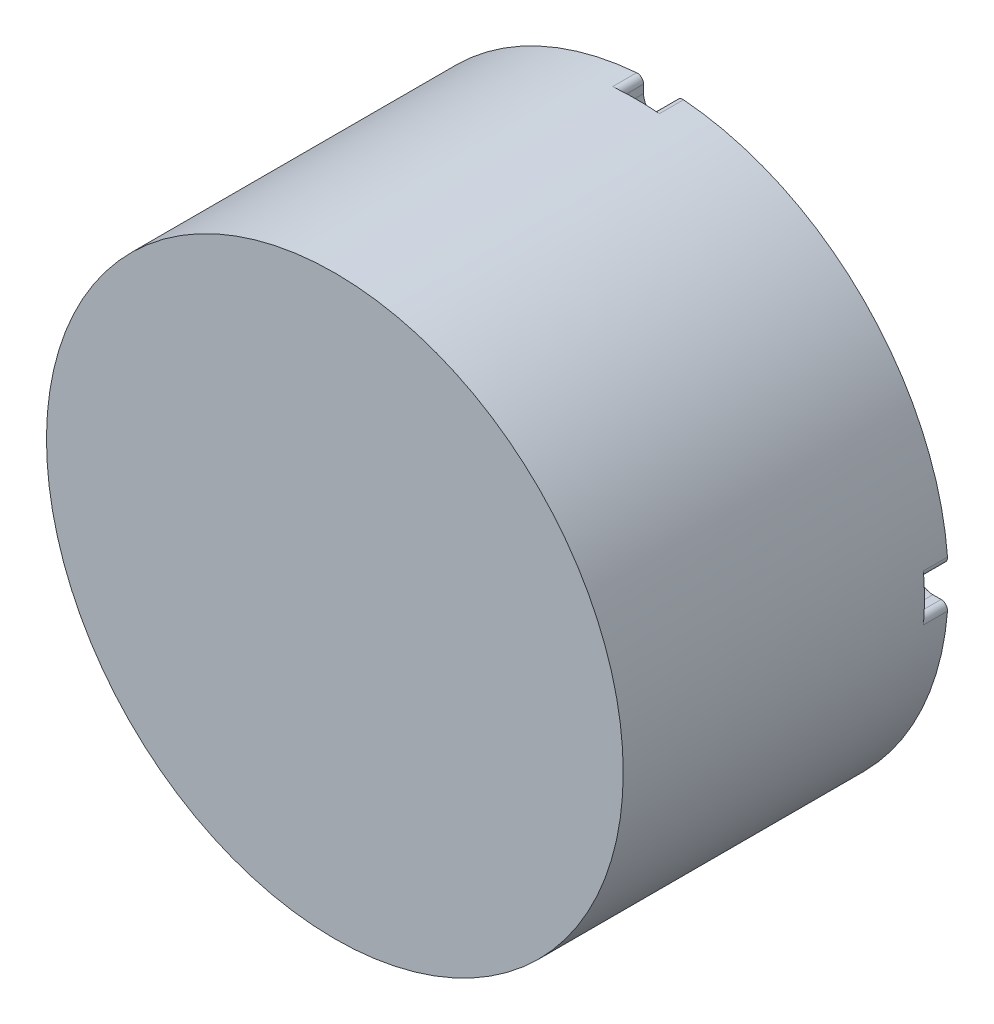
from build123d import *

# Parameters (mm, degrees)
SKETCH1_R                = 90
BOSS_EXTRUDE1_DEPTH      = 101.5
CUT_EXTRUDE1_DEPTH       = 7.5
FILLET1_R                = 2
CIRPATTERN1_COUNT        = 4
FILLET1_OF_CIRPATTERN1_R = 2
SKETCH6_R                = 75
BOSS_EXTRUDE2_DEPTH      = 3
SKETCH7_R                = 57
BOSS_EXTRUDE3_DEPTH      = 3
SKETCH8_R                = 17.5
CUT_EXTRUDE2_DEPTH       = 10
SKETCH9_R                = 10
BOSS_EXTRUDE4_DEPTH      = 42
CUT_EXTRUDE3_START       = -20
CUT_EXTRUDE3_DEPTH       = 20
CUT_EXTRUDE4_DEPTH       = 167.698712469


with BuildPart() as part:
    # Sketch1 → Boss-Extrude1 (new body)
    with BuildSketch(Plane.XY):
        with Locations(Location((0, 0, 0), (0, 0, 180))):
            Circle(SKETCH1_R)
    extrude(amount=BOSS_EXTRUDE1_DEPTH)

    # Sketch2 → Cut-Extrude1 (cut)
    with BuildSketch(Plane(origin=(0, 0, 0), x_dir=(-1, 0, 0), z_dir=(0, 0, -1))):
        with BuildLine():
            Line((-5.15, 89.852531962), (-5.15, 85.15))
            ThreePointArc((-5.15, 85.15), (0, 80), (5.15, 85.15))
            Line((5.15, 85.15), (5.15, 89.852531962))
            ThreePointArc((5.15, 89.852531962), (0, 90), (-5.15, 89.852531962))
        make_face()
    cut_extrude1 = extrude(amount=-CUT_EXTRUDE1_DEPTH, mode=Mode.SUBTRACT)

    # Fillet1
    fillet1_edges = [part.edges().sort_by_distance(p)[0] for p in [
        (-5.15, 89.852531962, 3.75),
        (5.15, 89.852531962, 3.75),
    ]]
    fillet(fillet1_edges, radius=FILLET1_R)

    # Sketch5 → Tap Drill for M8 Tap1 (revolve, cut)
    with BuildSketch(Plane(origin=(-60.104076401, 60.104076401, 0), x_dir=(0, 1, 0), z_dir=(1, 0, 0))):
        Polygon((0, 0), (0, 15.5), (3.4, 13.457073895), (3.4, 0), align=None)
    tap_drill_for_m8_tap1 = revolve(axis=Axis((-60.104076401, 60.104076401, -6.35), (0, 0, 1)), mode=Mode.SUBTRACT)

    # CirPattern1: Cut-Extrude1, Tap Drill for M8 Tap1 ×4 about axis
    cirpattern1_axis = Axis((0, 0, 0), (0, 0, 1))
    add([cut_extrude1.rotate(cirpattern1_axis, i * 360 / CIRPATTERN1_COUNT) for i in range(1, CIRPATTERN1_COUNT)], mode=Mode.SUBTRACT)
    add([tap_drill_for_m8_tap1.rotate(cirpattern1_axis, i * 360 / CIRPATTERN1_COUNT) for i in range(1, CIRPATTERN1_COUNT)], mode=Mode.SUBTRACT)

    # Fillet1 of CirPattern1
    fillet1_of_cirpattern1_edges = [part.edges().sort_by_distance(p)[0] for p in [
        (-89.852531962, -5.15, 3.75),
        (-89.852531962, 5.15, 3.75),
        (5.15, -89.852531962, 3.75),
        (-5.15, -89.852531962, 3.75),
        (89.852531962, 5.15, 3.75),
        (89.852531962, -5.15, 3.75),
    ]]
    fillet(fillet1_of_cirpattern1_edges, radius=FILLET1_OF_CIRPATTERN1_R)

    # Sketch6 → Boss-Extrude2 (add)
    with BuildSketch(Plane(origin=(0, 0, 0), x_dir=(-1, 0, 0), z_dir=(0, 0, -1))):
        with Locations(Location((0, 0, 0), (0, 0, 180))):
            Circle(SKETCH6_R)
    extrude(amount=BOSS_EXTRUDE2_DEPTH)

    # Sketch7 → Boss-Extrude3 (add)
    with BuildSketch(Plane(origin=(0, 0, -3), x_dir=(-1, 0, 0), z_dir=(0, 0, -1))):
        Circle(SKETCH7_R)
    extrude(amount=BOSS_EXTRUDE3_DEPTH)

    # Sketch8 → Cut-Extrude2 (cut)
    with BuildSketch(Plane(origin=(0, 0, -6), x_dir=(-1, 0, 0), z_dir=(0, 0, -1))):
        Circle(SKETCH8_R)
    extrude(amount=-CUT_EXTRUDE2_DEPTH, mode=Mode.SUBTRACT)

    # Sketch9 → Boss-Extrude4 (add)
    with BuildSketch(Plane(origin=(0, 0, 4), x_dir=(-1, 0, 0), z_dir=(0, 0, -1))):
        with Locations(Location((0, 0, 0), (0, 0, 180))):
            Circle(SKETCH9_R)
    extrude(amount=BOSS_EXTRUDE4_DEPTH)

    # Sketch10 → Cut-Extrude3 (cut)
    with BuildSketch(Plane(origin=(0, 0, -38), x_dir=(-1, 0, 0), z_dir=(0, 0, -1)).offset(CUT_EXTRUDE3_START)):
        with BuildLine():
            Line((-2.5, 9.682458366), (-2.5, 6.882458366))
            Line((-2.5, 6.882458366), (2.5, 6.882458366))
            Line((2.5, 6.882458366), (2.5, 9.682458366))
            ThreePointArc((2.5, 9.682458366), (0, 10), (-2.5, 9.682458366))
        make_face()
    extrude(amount=CUT_EXTRUDE3_DEPTH, mode=Mode.SUBTRACT)

    # Sketch11 → Cut-Extrude4 (cut, through all)
    with BuildSketch(Plane(origin=(0, 6.882458366, 0), x_dir=(1, 0, 0), z_dir=(0, 1, 0))):
        with BuildLine():
            Line((2.5, 18), (-2.5, 18))
            ThreePointArc((-2.5, 18), (0, 15.5), (2.5, 18))
        make_face()
    extrude(amount=CUT_EXTRUDE4_DEPTH, mode=Mode.SUBTRACT)


solid = part.part
